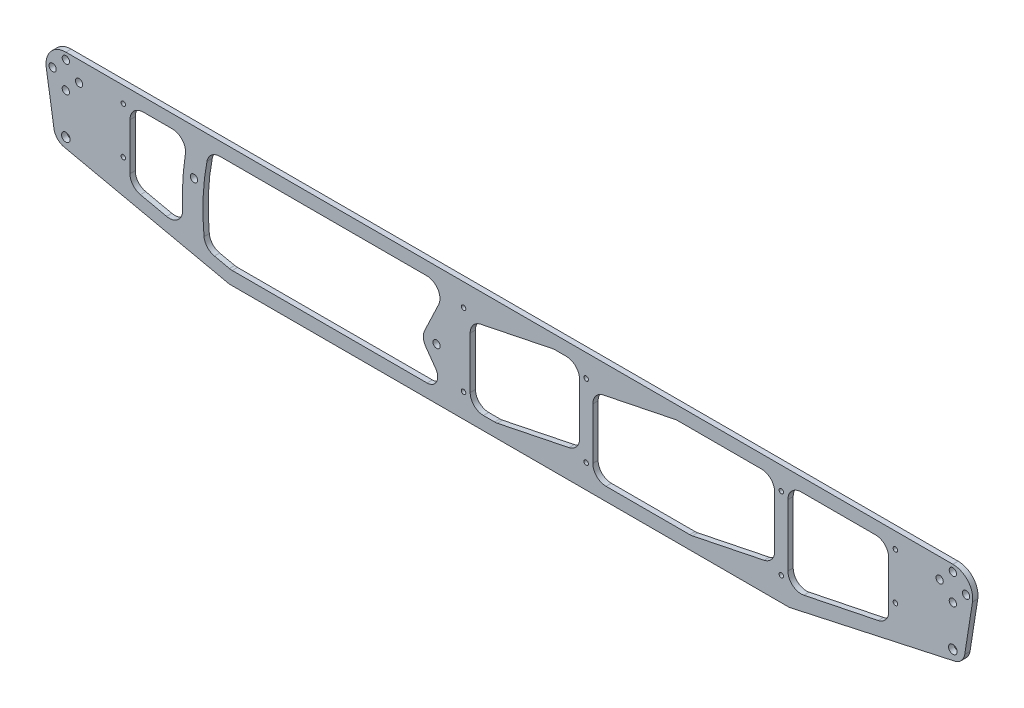
from build123d import *

# Parameters (mm, degrees)
SKETCH_1_R          = 3.25
EXTRUDE_1_DEPTH     = 4
HOLE_WIZARD_M51_D   = 5.5
HOLE_WIZARD_M52_D   = 5.5
CUT_EXTRUDE_3_DEPTH = 353.903669576
FILLET_2_R          = 10
FILLET_3_R          = 10
HOLE_WIZARD_M31_D   = 3.4
FILLET_4_R          = 8


with BuildPart() as part:
    # Эскиз1 → Бобышка-Вытянуть1 (new body)
    with BuildSketch(Plane.XY):
        with BuildLine():
            Line((-349.818316726, 27.672449915), (-342.910885265, -16.303620822))
            Line((-342.910885265, -16.303620822), (-211.481081006, -45))
            Line((-211.481081006, -45), (211.481081006, -45))
            Line((211.481081006, -45), (342.910885265, -16.303620822))
            Line((342.910885265, -16.303620822), (349.818316726, 27.672449915))
            ThreePointArc((349.818316726, 27.672449915), (346.399852001, 39.749019149), (335, 45))
            Line((335, 45), (-335, 45))
            ThreePointArc((-335, 45), (-346.399852001, 39.749019149), (-349.818316726, 27.672449915))
        make_face()
        with Locations((-335, -10.635315981)):
            Circle(SKETCH_1_R, mode=Mode.SUBTRACT)
        with Locations(Location((335, -10.635315981, 0), (0, 0, 180))):
            Circle(SKETCH_1_R, mode=Mode.SUBTRACT)
    extrude(amount=EXTRUDE_1_DEPTH)

    # Отверстие с зазором M51 (through all)
    with Locations(Plane.XY.offset(4)):
        with Locations((-335, 40), (-345, 30), (-335, 20), (-325, 30), (325, 30), (335, 40), (345, 30), (335, 20)):
            Hole(HOLE_WIZARD_M51_D / 2)

    # Отверстие с зазором M52 (through all)
    with Locations(Plane(origin=(0, 0, 0), x_dir=(-1, 0, 0), z_dir=(0, 0, -1))):
        with Locations((55, -6), (238.23, 10.84)):
            Hole(HOLE_WIZARD_M52_D / 2)

    # Эскиз10 → Вырез-Вытянуть3 (cut, through all)
    with BuildSketch(Plane.XY.offset(4)):
        with BuildLine():
            Line((-286.571319769, 35), (-242.571319769, 35))
            ThreePointArc((-242.571319769, 35), (-246.739453064, 3.999106889), (-245.818518827, -27.267178292))
            Line((-245.818518827, -27.267178292), (-286.571319769, -18.369213063))
            Line((-286.571319769, -18.369213063), (-286.571319769, 35))
        make_face()
        with BuildLine():
            Line((-226.671925486, 35), (-46.587816989, 35))
            Line((-46.587816989, 35), (-64.032014151, -1.707830342))
            ThreePointArc((-64.032014151, -1.707830342), (-64.961194769, -6.880112935), (-63.13950341, -11.809344562))
            Line((-63.13950341, -11.809344562), (-46.587816989, -35))
            Line((-46.587816989, -35), (-210.402090952, -35))
            Line((-210.402090952, -35), (-229.752534006, -30.775024894))
            ThreePointArc((-229.752534006, -30.775024894), (-231.306735573, 2.257420391), (-226.671925486, 35))
        make_face()
        Polygon((286.571319769, 35), (286.571319769, -18.369213063), (210.402090952, -34), (210.402090952, 35), align=None)
        Polygon((200.402090952, 35), (126.145146633, 35), (63.036502818, 22.049392771), (63.036502818, -35), (137.293447136, -35), (200.402090952, -22.049392771), align=None)
        Polygon((-29.597909048, 22.049392771), (-29.597909048, -35), (-10.072140997, -35), (53.036502818, -22.049392771), (53.036502818, 35), (33.510734767, 35), align=None)
    extrude(amount=-CUT_EXTRUDE_3_DEPTH, mode=Mode.SUBTRACT)

    # Скругление2
    fillet_2_edges = [part.edges().sort_by_distance(p)[0] for p in [
        (210.402090952, 35, 2),
        (286.571319769, 35, 2),
        (286.571319769, -18.369213063, 2),
        (210.402090952, -34, 2),
        (-210.402090952, -35, 2),
        (-229.752534006, -30.775024894, 2),
        (-226.671925486, 35, 2),
        (-46.587816989, 35, 2),
        (342.910885265, -16.303620822, 2),
        (211.481081006, -45, 2),
        (-211.481081006, -45, 2),
        (-342.910885265, -16.303620822, 2),
        (-286.571319769, -18.369213063, 2),
        (-286.571319769, 35, 2),
        (-242.571319769, 35, 2),
        (-245.818518827, -27.267178292, 2),
    ]]
    fillet(fillet_2_edges, radius=FILLET_2_R)

    # Скругление3
    fillet_3_edges = [part.edges().sort_by_distance(p)[0] for p in [
        (63.036502818, 22.049392771, 2),
        (126.145146633, 35, 2),
        (200.402090952, 35, 2),
        (200.402090952, -22.049392771, 2),
        (137.293447136, -35, 2),
        (63.036502818, -35, 2),
        (33.510734767, 35, 2),
        (53.036502818, 35, 2),
        (53.036502818, -22.049392771, 2),
        (-10.072140997, -35, 2),
        (-29.597909048, -35, 2),
        (-29.597909048, 22.049392771, 2),
    ]]
    fillet(fillet_3_edges, radius=FILLET_3_R)

    # Отверстие с зазором M31 (through all)
    with Locations(Plane.XY.offset(4)):
        with Locations((-34.597909048, 28), (-34.597909048, -27), (205.402090952, -27), (205.402090952, 28), (291.571319769, 33), (291.6163356, -2), (-291.6163356, -2), (-291.571319769, 33), (58.036502818, 28), (58.036502818, -27)):
            Hole(HOLE_WIZARD_M31_D / 2)

    # Скругление4
    fillet_4_edges = [part.edges().sort_by_distance(p)[0] for p in [
        (-46.587816989, -35, 2),
    ]]
    fillet(fillet_4_edges, radius=FILLET_4_R)


solid = part.part
